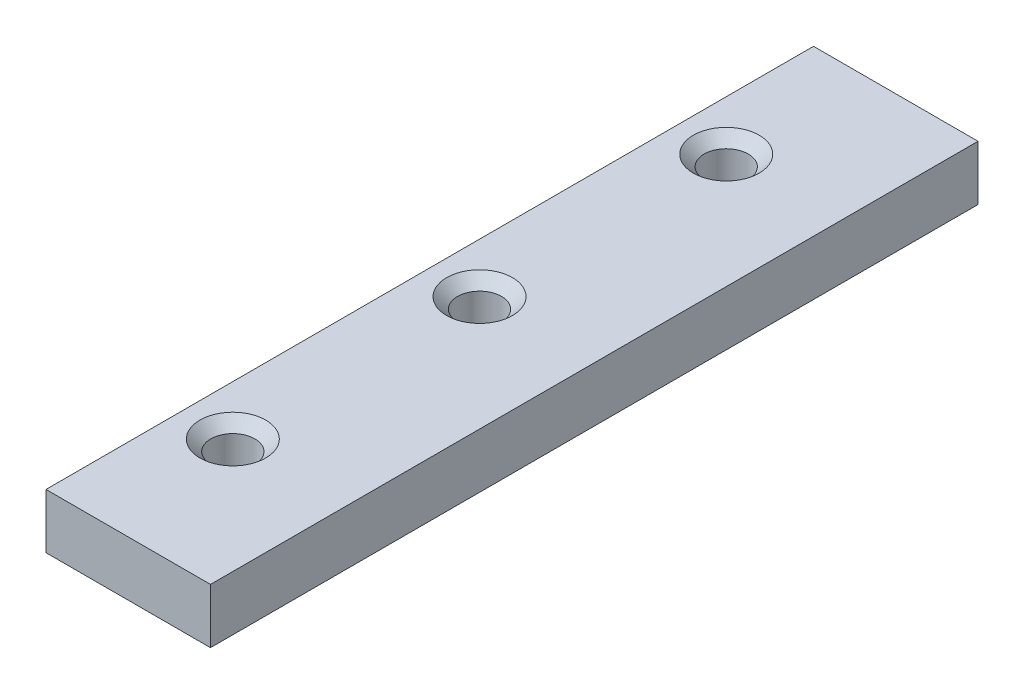
from build123d import *

# Parameters (mm, degrees)
SKETCH1_W                         = 19.05
SKETCH1_H                         = 88.9
BOSS_EXTRUDE1_DEPTH               = 6.35
F_1_4_20_TAPPED_HOLE1_D           = 5.1054
F_1_4_20_TAPPED_HOLE1_CSINK_D     = 7.62
F_1_4_20_TAPPED_HOLE1_CSINK_ANGLE = 90


with BuildPart() as part:
    # Sketch1 → Boss-Extrude1 (new body)
    with BuildSketch(Plane(origin=(0, 0, 0), x_dir=(1, 0, 0), z_dir=(0, 1, 0))):
        with Locations((-9.525, 44.45)):
            Rectangle(SKETCH1_W, SKETCH1_H)
    extrude(amount=BOSS_EXTRUDE1_DEPTH)

    # 1/4-20 Tapped Hole1 (through all)
    with Locations(Plane(origin=(0, 6.35, 0), x_dir=(1, 0, 0), z_dir=(0, 1, 0))):
        with Locations((-13.284419072, 15.875), (-13.284419072, 44.45), (-13.284419072, 73.025)):
            CounterSinkHole(F_1_4_20_TAPPED_HOLE1_D / 2, F_1_4_20_TAPPED_HOLE1_CSINK_D / 2, counter_sink_angle=F_1_4_20_TAPPED_HOLE1_CSINK_ANGLE)


solid = part.part
